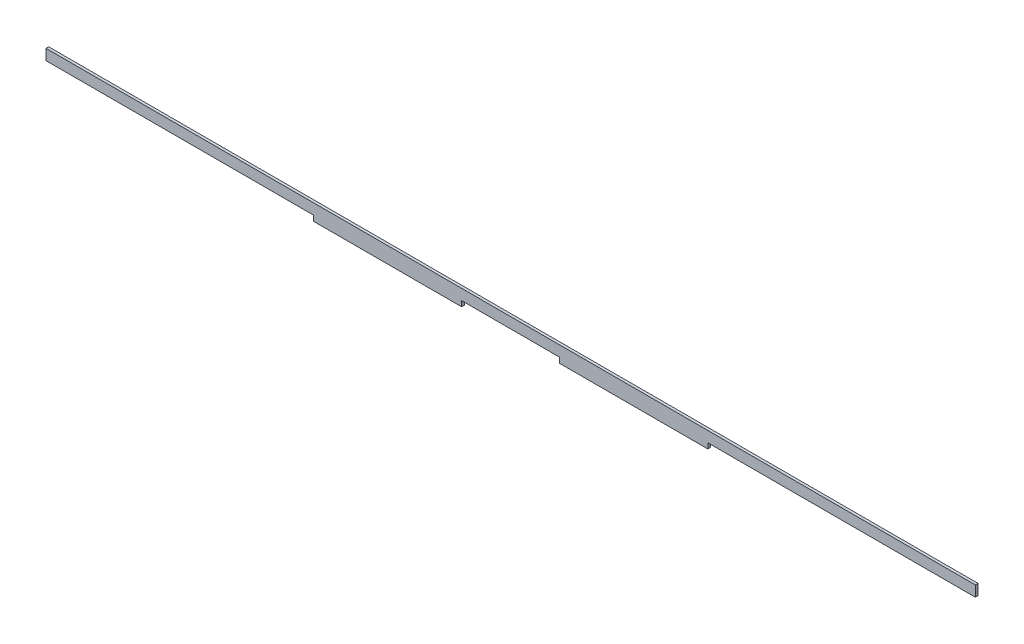
from build123d import *

# Parameters (mm, degrees)
BOSS_EXTRUDE1_DEPTH = 3


with BuildPart() as part:
    # Sketch1 → Boss-Extrude1 (new body)
    with BuildSketch(Plane.XY):
        Polygon((-250.162506049, 19.715764798), (791.837493951, 19.715764798), (791.837493951, 7.715764798), (491.837493951, 7.715764798), (491.837493951, 1.715764798), (325.837493951, 1.715764798), (325.837493951, 7.715764798), (215.837493951, 7.715764798), (215.837493951, 1.715764798), (49.837493951, 1.715764798), (49.837493951, 7.715764798), (-250.162506049, 7.715764798), align=None)
    extrude(amount=BOSS_EXTRUDE1_DEPTH)


solid = part.part
